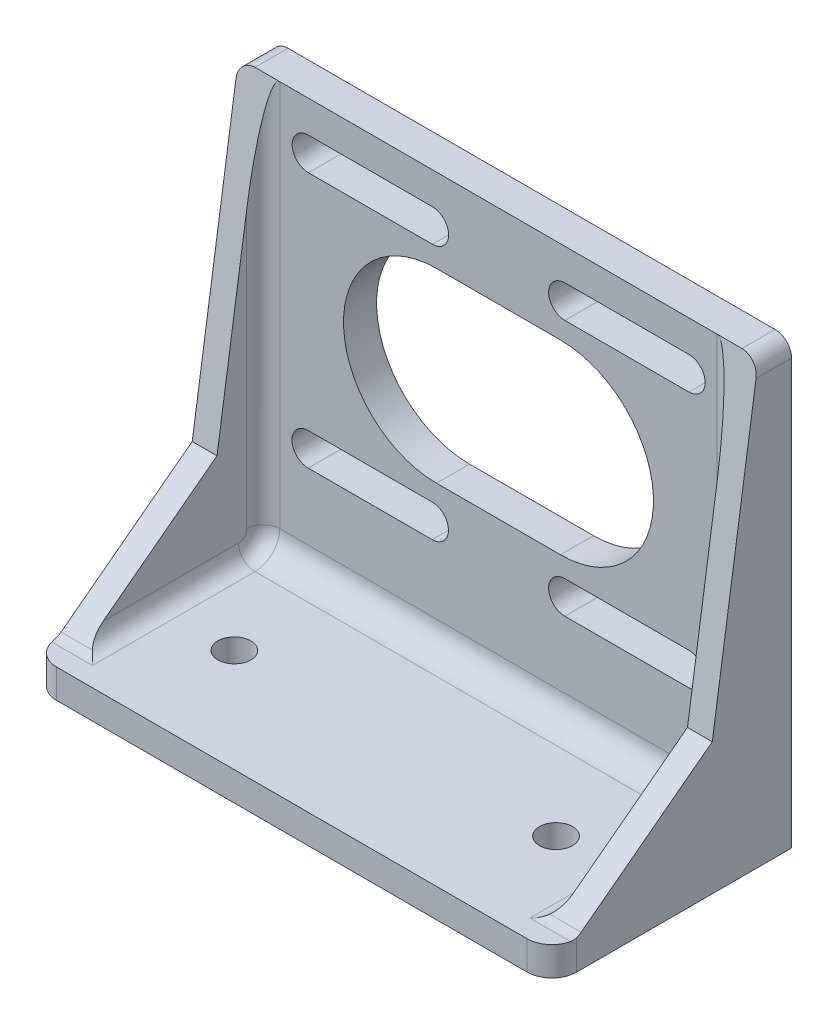
from build123d import *

# Parameters (mm, degrees)
SKETCH_1_W          = 62.922128066
SKETCH_1_H          = 53.34190314
EXTRUDE_1_DEPTH     = 4
SKETCH_2_W          = 62.922128066
SKETCH_2_H          = 3.5
EXTRUDE_2_DEPTH     = 25
CUT_EXTRUDE_1_REACH = 67.689
SKETCH_3_R          = 2
FILLET_1_R          = 3
EXTRUDE_3_DEPTH     = 3
EXTRUDE_4_DEPTH     = 3
FILLET_2_R          = 2


with BuildPart() as part:
    # Эскиз1 → Бобышка-Вытянуть1 (new body)
    with BuildSketch(Plane.XY):
        with Locations((0, -5.32904843)):
            Rectangle(SKETCH_1_W, SKETCH_1_H)
        with BuildLine():
            Line((-7.5, 11.25), (7.5, 11.25))
            ThreePointArc((7.5, 11.25), (18.75, 0), (7.5, -11.25))
            Line((7.5, -11.25), (-7.5, -11.25))
            ThreePointArc((-7.5, -11.25), (-18.75, 0), (-7.5, 11.25))
        make_face(mode=Mode.SUBTRACT)
        with BuildLine():
            Line((-23, 17.468671613), (-8, 17.468671613))
            ThreePointArc((-8, 17.468671613), (-6.031328387, 15.5), (-8, 13.531328387))
            Line((-8, 13.531328387), (-23, 13.531328387))
            ThreePointArc((-23, 13.531328387), (-24.968671613, 15.5), (-23, 17.468671613))
        make_face(mode=Mode.SUBTRACT)
        with BuildLine():
            Line((8.035969411, 17.506216751), (23.035969411, 17.506216751))
            ThreePointArc((23.035969411, 17.506216751), (25.004641024, 15.537545138), (23.035969411, 13.568873525))
            Line((23.035969411, 13.568873525), (8.035969411, 13.568873525))
            ThreePointArc((8.035969411, 13.568873525), (6.067297798, 15.537545138), (8.035969411, 17.506216751))
        make_face(mode=Mode.SUBTRACT)
        with BuildLine():
            Line((-23.022315975, -13.49101169), (-8.022315975, -13.49101169))
            ThreePointArc((-8.022315975, -13.49101169), (-6.053644362, -15.459683303), (-8.022315975, -17.428354916))
            Line((-8.022315975, -17.428354916), (-23.022315975, -17.428354916))
            ThreePointArc((-23.022315975, -17.428354916), (-24.990987588, -15.459683303), (-23.022315975, -13.49101169))
        make_face(mode=Mode.SUBTRACT)
        with BuildLine():
            Line((8.028946211, -13.4897295), (23.028946211, -13.4897295))
            ThreePointArc((23.028946211, -13.4897295), (24.997617824, -15.458401113), (23.028946211, -17.427072726))
            Line((23.028946211, -17.427072726), (8.028946211, -17.427072726))
            ThreePointArc((8.028946211, -17.427072726), (6.060274598, -15.458401113), (8.028946211, -13.4897295))
        make_face(mode=Mode.SUBTRACT)
    extrude(amount=EXTRUDE_1_DEPTH)

    # Эскиз2 → Бобышка-Вытянуть2 (add)
    with BuildSketch(Plane.XY.offset(4)):
        with Locations((0, -30.25)):
            Rectangle(SKETCH_2_W, SKETCH_2_H)
    extrude(amount=EXTRUDE_2_DEPTH)

    # Эскиз3 → Вырез-Вытянуть1 (cut, up to next)
    with BuildSketch(Plane(origin=(0, -28.5, 0), x_dir=(1, 0, 0), z_dir=(0, 1, 0)), mode=Mode.PRIVATE) as cut_extrude_1_sk1:
        with Locations(Location((-19.461064033, -16.5, 0), (0, 0, 270))):
            Circle(SKETCH_3_R)
    cut_extrude_1_tool1 = extrude(cut_extrude_1_sk1.sketch, amount=-CUT_EXTRUDE_1_REACH, mode=Mode.PRIVATE) & part.part
    # Эскиз3 → Вырез-Вытянуть1 (cut, up to next)
    with BuildSketch(Plane(origin=(0, -28.5, 0), x_dir=(1, 0, 0), z_dir=(0, 1, 0)), mode=Mode.PRIVATE) as cut_extrude_1_sk2:
        with Locations(Location((19.461064033, -16.5, 0), (0, 0, 270))):
            Circle(SKETCH_3_R)
    cut_extrude_1_tool2 = extrude(cut_extrude_1_sk2.sketch, amount=-CUT_EXTRUDE_1_REACH, mode=Mode.PRIVATE) & part.part
    add(cut_extrude_1_tool1.solids().sort_by_distance((-19.461064, -28.5, 16.5))[0], mode=Mode.SUBTRACT)
    add(cut_extrude_1_tool2.solids().sort_by_distance((19.461064, -28.5, 16.5))[0], mode=Mode.SUBTRACT)

    # Скругление1
    fillet_1_edges = [part.edges().sort_by_distance(p)[0] for p in [
        (0, -28.5, 4),
        (-31.461064033, -30.25, 29),
        (31.461064033, -30.25, 29),
    ]]
    fillet(fillet_1_edges, radius=FILLET_1_R)

    # Эскиз4 → Бобышка-Вытянуть3 (add)
    with BuildSketch(Plane(origin=(31.461064033, 0, 0), x_dir=(0, 0, -1), z_dir=(1, 0, 0))):
        Polygon((-26, -28.5), (-4, -28.5), (-4, 21.34190314), (-9.595875894, -16.066108025), align=None)
    extrude(amount=-EXTRUDE_3_DEPTH)

    # Эскиз5 → Бобышка-Вытянуть4 (add)
    with BuildSketch(Plane.ZY.offset(31.461064033)):
        Polygon((26, -28.5), (4, -28.5), (4, 21.34190314), (9.595875894, -16.066108025), align=None)
    extrude(amount=-EXTRUDE_4_DEPTH)

    # Скругление2
    fillet_2_edges = [part.edges().sort_by_distance(p)[0] for p in [
        (28.461064033, -27.621320344, 4.878679656),
        (28.461064033, -2.07904843, 4),
        (29.961064033, -28.5, 26),
        (28.461064033, -28.5, 16.5),
        (-28.461064033, -27.621320344, 4.878679656),
        (-28.461064033, -2.07904843, 4),
        (-28.461064033, -28.5, 16.5),
        (-29.961064033, -28.5, 26),
        (-31.461064033, 21.34190314, 2),
        (31.461064033, 21.34190314, 2),
    ]]
    fillet(fillet_2_edges, radius=FILLET_2_R)


solid = part.part
